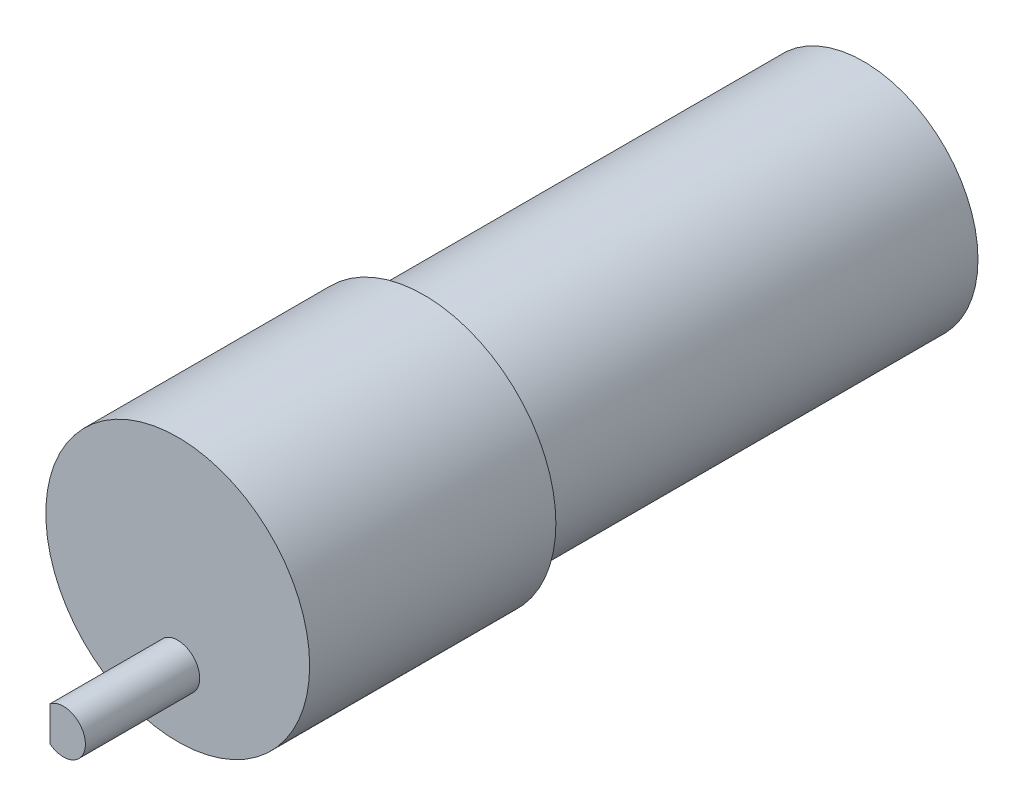
from build123d import *

# Parameters (mm, degrees)
SKETCH1_R           = 13
BOSS_EXTRUDE1_DEPTH = 50
SKETCH2_R           = 15
BOSS_EXTRUDE2_DEPTH = 28
SKETCH3_R           = 2.5
BOSS_EXTRUDE3_DEPTH = 13
SKETCH4_W           = 2
SKETCH4_H           = 4
CUT_EXTRUDE1_DEPTH  = 13


with BuildPart() as part:
    # Sketch1 → Boss-Extrude1 (new body)
    with BuildSketch(Plane.XY):
        Circle(SKETCH1_R)
    extrude(amount=BOSS_EXTRUDE1_DEPTH)

    # Sketch2 → Boss-Extrude2 (add)
    with BuildSketch(Plane.XY.offset(50)):
        Circle(SKETCH2_R)
    extrude(amount=BOSS_EXTRUDE2_DEPTH)

    # Sketch3 → Boss-Extrude3 (add)
    with BuildSketch(Plane.XY.offset(78)):
        with Locations(Location((0, -7.5, 0), (0, 0, 180))):
            Circle(SKETCH3_R)
    extrude(amount=BOSS_EXTRUDE3_DEPTH)

    # Sketch4 → Cut-Extrude1 (cut)
    with BuildSketch(Plane.XY.offset(91)):
        with Locations((-2.5, -7.5)):
            Rectangle(SKETCH4_W, SKETCH4_H)
    extrude(amount=-CUT_EXTRUDE1_DEPTH, mode=Mode.SUBTRACT)


solid = part.part
